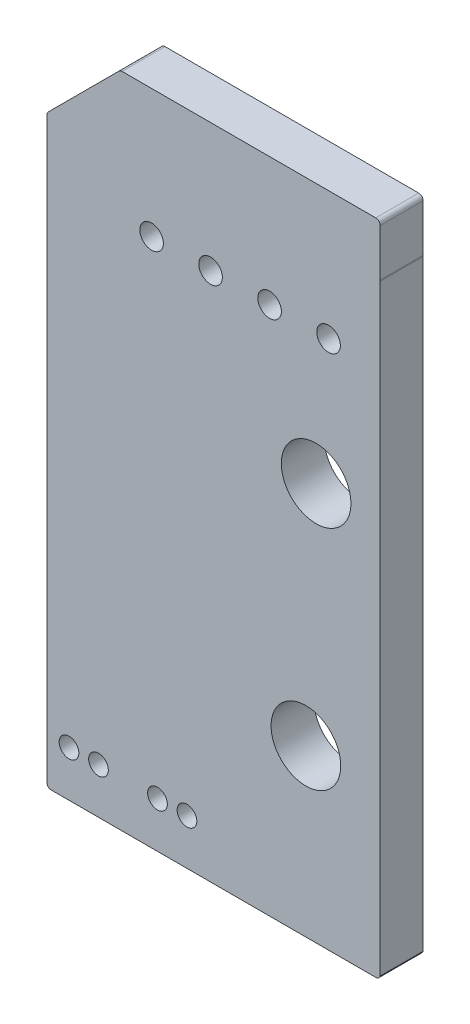
from build123d import *

# Parameters (mm, degrees)
SKETCH1_R           = 0.423839805
SKETCH1_R_2         = 1.499879549
SKETCH1_R_3         = 0.508
BOSS_EXTRUDE1_DEPTH = 1.85


with BuildPart() as part:
    # Sketch1 → Boss-Extrude1 (new body)
    with BuildSketch(Plane.XY):
        with BuildLine():
            ThreePointArc((-7.175495363, -13.940801921), (-7.119699204, -14.075505763), (-6.984995363, -14.131301921))
            Line((-6.984995363, -14.131301921), (6.985004637, -14.131301921))
            ThreePointArc((6.985004637, -14.131301921), (7.099326594, -14.093185451), (7.1679, -13.994089221))
            Line((7.1679, -13.994089221), (7.1679, 11.913928619))
            ThreePointArc((7.1679, 11.913928619), (7.173590429, 11.94029461), (7.1755, 11.9672))
            Line((7.1755, 11.9672), (7.1755, 13.9992))
            ThreePointArc((7.1755, 13.9992), (7.119703561, 14.133900844), (6.985001921, 14.189695363))
            Line((6.985001921, 14.189695363), (-3.936998079, 14.189695363))
            ThreePointArc((-3.936998079, 14.189695363), (-4.009898233, 14.17519462), (-4.0717, 14.1339))
            Line((-4.0717, 14.1339), (-7.1197, 11.0859))
            ThreePointArc((-7.1197, 11.0859), (-7.16099462, 11.024098233), (-7.175495363, 10.951198079))
            Line((-7.175495363, 10.951198079), (-7.175495363, -13.940801921))
        make_face()
        with Locations((-6.223, -12.1628)):
            Circle(SKETCH1_R, mode=Mode.SUBTRACT)
        with Locations((-4.953, -12.1628)):
            Circle(SKETCH1_R, mode=Mode.SUBTRACT)
        with Locations((-2.413, -12.1628)):
            Circle(SKETCH1_R, mode=Mode.SUBTRACT)
        with Locations((-1.143, -12.1628)):
            Circle(SKETCH1_R, mode=Mode.SUBTRACT)
        with Locations((3.97765, -6.999)):
            Circle(SKETCH1_R_2, mode=Mode.SUBTRACT)
        with Locations((4.416979549, 3.001)):
            Circle(SKETCH1_R_2, mode=Mode.SUBTRACT)
        with Locations((-2.667, 8.6652)):
            Circle(SKETCH1_R_3, mode=Mode.SUBTRACT)
        with Locations((-0.127, 8.6652)):
            Circle(SKETCH1_R_3, mode=Mode.SUBTRACT)
        with Locations((2.413, 8.6652)):
            Circle(SKETCH1_R_3, mode=Mode.SUBTRACT)
        with Locations((4.953, 8.6652)):
            Circle(SKETCH1_R_3, mode=Mode.SUBTRACT)
    extrude(amount=BOSS_EXTRUDE1_DEPTH)


solid = part.part
